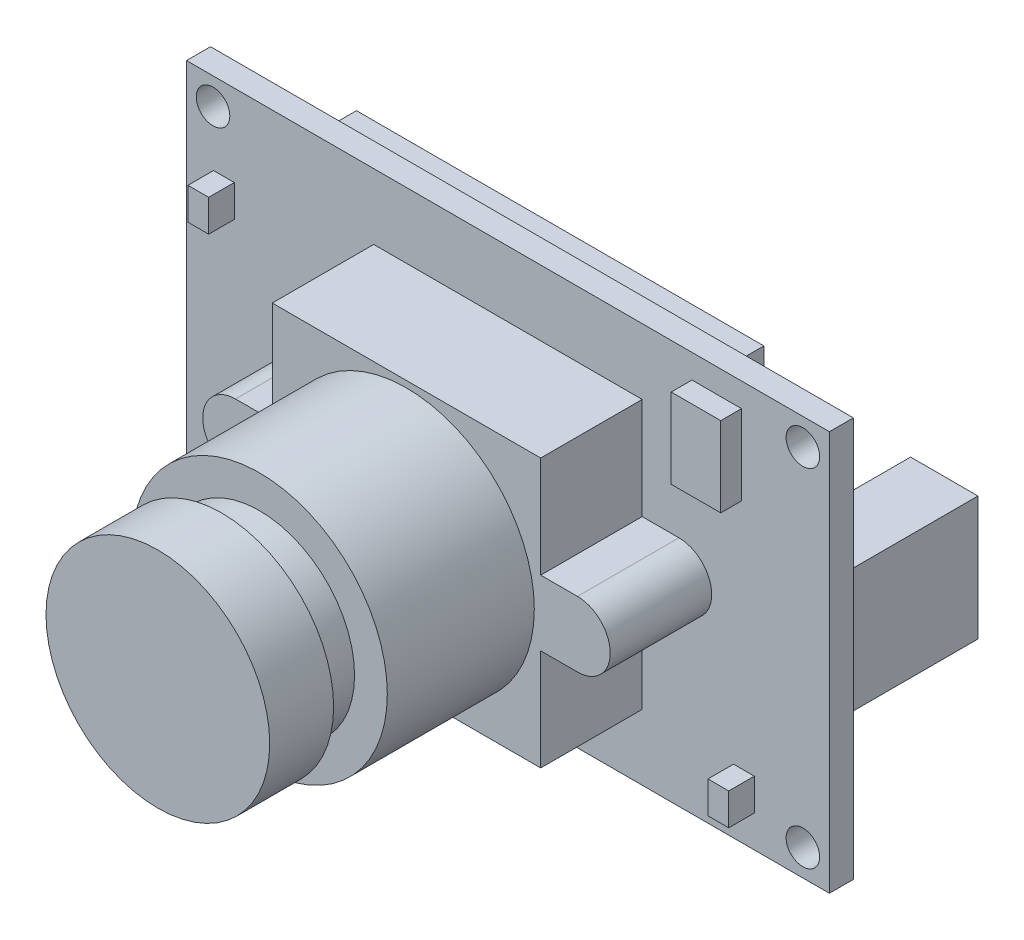
from build123d import *

# Parameters (mm, degrees)
SKETCH2_W            = 40.2336
SKETCH2_H            = 25.019
SKETCH2_R            = 1.05
BOSS_EXTRUDE1_DEPTH  = 1.5
BOSS_EXTRUDE2_DEPTH  = 6.35
SKETCH4_R            = 8
BOSS_EXTRUDE3_DEPTH  = 9.2
SKETCH5_R            = 5.95
BOSS_EXTRUDE4_DEPTH  = 2.36
SKETCH6_R            = 7
BOSS_EXTRUDE5_DEPTH  = 4
SKETCH7_W            = 4.22
SKETCH7_H            = 7.75
BOSS_EXTRUDE6_DEPTH  = 8.3
SKETCH8_W            = 9
SKETCH8_H            = 2.93
BOSS_EXTRUDE7_DEPTH  = 4.35
SKETCH9_W            = 3.1
SKETCH9_H            = 5
BOSS_EXTRUDE8_DEPTH  = 1.3
SKETCH10_W           = 25.5
SKETCH10_H           = 8
BOSS_EXTRUDE9_DEPTH  = 1.4
SKETCH11_W           = 1.3
SKETCH11_H           = 2
BOSS_EXTRUDE10_DEPTH = 1.6
SKETCH12_W           = 3
SKETCH12_H           = 3
BOSS_EXTRUDE11_DEPTH = 1.4


with BuildPart() as part:
    # Sketch2 → Boss-Extrude1 (new body)
    with BuildSketch(Plane.XY):
        Rectangle(SKETCH2_W, SKETCH2_H)
        with Locations((-18.4568, 10.8495)):
            Circle(SKETCH2_R, mode=Mode.SUBTRACT)
        with Locations(Location((-18.4568, -10.8495, 0), (0, 0, 180))):
            Circle(SKETCH2_R, mode=Mode.SUBTRACT)
        with Locations((18.4568, -10.8495)):
            Circle(SKETCH2_R, mode=Mode.SUBTRACT)
        with Locations(Location((18.4568, 10.8495, 0), (0, 0, 180))):
            Circle(SKETCH2_R, mode=Mode.SUBTRACT)
    extrude(amount=BOSS_EXTRUDE1_DEPTH)

    # Sketch3 → Boss-Extrude2 (add)
    with BuildSketch(Plane.XY.offset(1.5)):
        with BuildLine():
            Line((-8.4, -2.05), (-8.4, -8.4))
            Line((-8.4, -8.4), (8.4, -8.4))
            Line((8.4, -8.4), (8.4, -2.05))
            Line((8.4, -2.05), (10.7, -2.05))
            ThreePointArc((10.7, -2.05), (12.75, 0), (10.7, 2.05))
            Line((10.7, 2.05), (8.4, 2.05))
            Line((8.4, 2.05), (8.4, 8.4))
            Line((8.4, 8.4), (-8.4, 8.4))
            Line((-8.4, 8.4), (-8.4, 2.05))
            Line((-8.4, 2.05), (-10.7, 2.05))
            ThreePointArc((-10.7, 2.05), (-12.75, 0), (-10.7, -2.05))
            Line((-10.7, -2.05), (-8.4, -2.05))
        make_face()
    extrude(amount=BOSS_EXTRUDE2_DEPTH)

    # Sketch4 → Boss-Extrude3 (add)
    with BuildSketch(Plane.XY.offset(7.85)):
        Circle(SKETCH4_R)
    extrude(amount=BOSS_EXTRUDE3_DEPTH)

    # Sketch5 → Boss-Extrude4 (add)
    with BuildSketch(Plane.XY.offset(17.05)):
        Circle(SKETCH5_R)
    extrude(amount=BOSS_EXTRUDE4_DEPTH)

    # Sketch6 → Boss-Extrude5 (add)
    with BuildSketch(Plane.XY.offset(19.41)):
        Circle(SKETCH6_R)
    extrude(amount=BOSS_EXTRUDE5_DEPTH)

    # Sketch7 → Boss-Extrude6 (add)
    with BuildSketch(Plane(origin=(0, 0, 0), x_dir=(-1, 0, 0), z_dir=(0, 0, -1))):
        with Locations((-17.5068, 0)):
            Rectangle(SKETCH7_W, SKETCH7_H)
    extrude(amount=BOSS_EXTRUDE6_DEPTH)

    # Sketch8 → Boss-Extrude7 (add)
    with BuildSketch(Plane(origin=(0, 0, 0), x_dir=(-1, 0, 0), z_dir=(0, 0, -1))):
        with Locations((11.1768, -9.4045)):
            Rectangle(SKETCH8_W, SKETCH8_H)
    extrude(amount=BOSS_EXTRUDE7_DEPTH)

    # Sketch9 → Boss-Extrude8 (add)
    with BuildSketch(Plane.XY.offset(1.5)):
        with Locations((13.0668, 8.5095)):
            Rectangle(SKETCH9_W, SKETCH9_H)
    extrude(amount=BOSS_EXTRUDE8_DEPTH)

    # Sketch10 → Boss-Extrude9 (add)
    with BuildSketch(Plane(origin=(0, 0, 0), x_dir=(-1, 0, 0), z_dir=(0, 0, -1))):
        with Locations((-0.3668, 8.2095)):
            Rectangle(SKETCH10_W, SKETCH10_H)
    extrude(amount=BOSS_EXTRUDE9_DEPTH)

    # Sketch11 → Boss-Extrude10 (add)
    with BuildSketch(Plane.XY.offset(1.5)):
        with Locations((14.7668, -9.5095)):
            Rectangle(SKETCH11_W, SKETCH11_H)
        with Locations((-17.777092667, 6.391636208)):
            Rectangle(SKETCH11_W, SKETCH11_H)
    extrude(amount=BOSS_EXTRUDE10_DEPTH)

    # Sketch12 → Boss-Extrude11 (add)
    with BuildSketch(Plane(origin=(0, 0, 0), x_dir=(-1, 0, 0), z_dir=(0, 0, -1))):
        with Locations((17.6168, 6.6095)):
            Rectangle(SKETCH12_W, SKETCH12_H)
    extrude(amount=BOSS_EXTRUDE11_DEPTH)


solid = part.part
